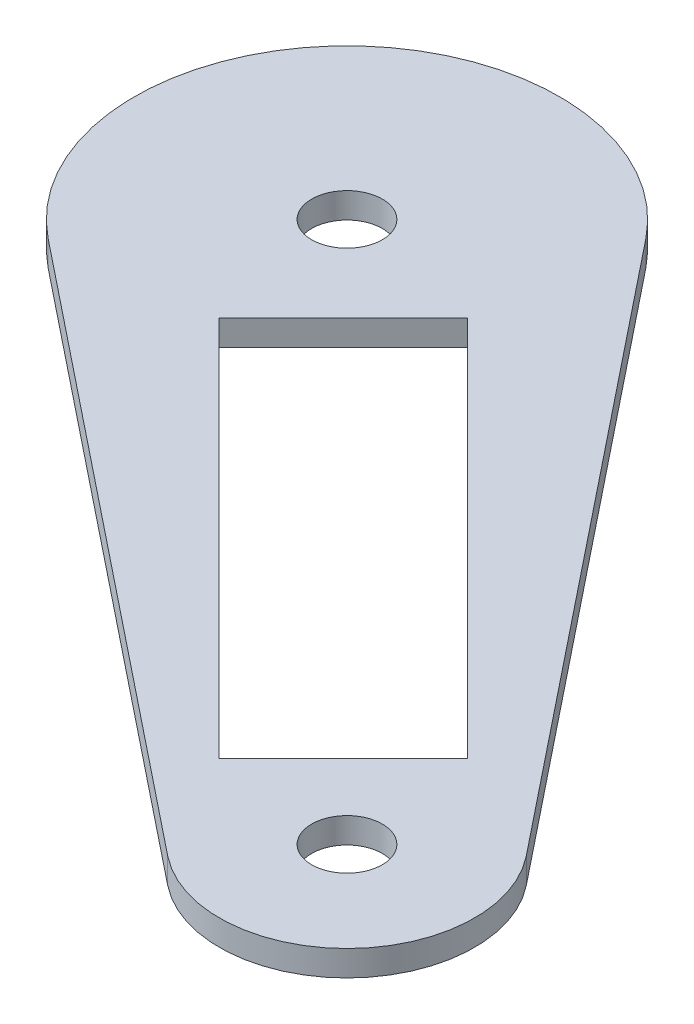
from build123d import *

# Parameters (mm, degrees)
SKETCH_1_R          = 4.15
EXTRUDE_1_DEPTH     = 3
EXTRUDE_2_DEPTH     = 12
CUT_EXTRUDE_1_DEPTH = 112.858735101
CUT_EXTRUDE_2_DEPTH = 112.858735101


with BuildPart() as part:
    # 草图1 → 凸台-拉伸1 (new body)
    with BuildSketch(Plane(origin=(0, 0, 0), x_dir=(1, 0, 0), z_dir=(0, 1, 0))):
        with BuildLine():
            ThreePointArc((19.532394726, 15.60402372), (-17.67766953, 17.67766953), (-15.60402372, -19.532394726))
            Line((-15.60402372, -19.532394726), (54.277196075, -75.359047143))
            ThreePointArc((54.277196075, -75.359047143), (74.246212025, -74.246212025), (75.359047143, -54.277196075))
            Line((75.359047143, -54.277196075), (19.532394726, 15.60402372))
        make_face()
        with Locations(Location((0, 0, 0), (0, 0, 270))):
            Circle(SKETCH_1_R, mode=Mode.SUBTRACT)
        with Locations(Location((63.639610307, -63.639610307, 0), (0, 0, 270))):
            Circle(SKETCH_1_R, mode=Mode.SUBTRACT)
    extrude(amount=EXTRUDE_1_DEPTH)

    # 草图3 → 凸台-拉伸2 (add)
    with BuildSketch(Plane(origin=(0, 3, 0), x_dir=(1, 0, 0), z_dir=(0, 1, 0))):
        with BuildLine():
            ThreePointArc((54.277196075, -75.359047143), (74.246212025, -74.246212025), (75.359047143, -54.277196075))
            Line((75.359047143, -54.277196075), (19.532394726, 15.60402372))
            ThreePointArc((19.532394726, 15.60402372), (-17.67766953, 17.67766953), (-15.60402372, -19.532394726))
            Line((-15.60402372, -19.532394726), (54.277196075, -75.359047143))
        make_face()
        with BuildLine():
            Line((17.969803148, 14.355701822), (73.796455565, -55.525517972))
            ThreePointArc((73.796455565, -55.525517972), (72.831998462, -72.831998462), (55.525517972, -73.796455565))
            Line((55.525517972, -73.796455565), (-14.355701822, -17.969803148))
            ThreePointArc((-14.355701822, -17.969803148), (-16.263455967, 16.263455967), (17.969803148, 14.355701822))
        make_face(mode=Mode.SUBTRACT)
    extrude(amount=EXTRUDE_2_DEPTH)

    # 草图4 → 切除-拉伸1 (cut, through all)
    with BuildSketch(Plane(origin=(0, 3, 0), x_dir=(1, 0, 0), z_dir=(0, 1, 0))):
        Polygon((17.133662373, -2.976992155), (10.055327264, -10.055327264), (54.909619217, -54.909619217), (61.987954325, -47.831284108), align=None)
        Polygon((54.909619217, -54.909619217), (10.055327264, -10.055327264), (2.529939412, -17.580715117), (47.384231364, -62.435007069), align=None)
    extrude(amount=-CUT_EXTRUDE_1_DEPTH, mode=Mode.SUBTRACT)

    # 草图5 → 切除-拉伸2 (cut, through all)
    with BuildSketch(Plane(origin=(0, 3, 0), x_dir=(1, 0, 0), z_dir=(0, 1, 0))):
        with BuildLine():
            Line((-6.700597737, -24.085306516), (-14.355701822, -17.969803148))
            ThreePointArc((-14.355701822, -17.969803148), (-16.263455967, 16.263455967), (17.969803148, 14.355701822))
            Line((17.969803148, 14.355701822), (24.085306516, 6.700597737))
            ThreePointArc((24.085306516, 6.700597737), (22.258564958, 11.382279474), (19.532394726, 15.60402372))
            ThreePointArc((19.532394726, 15.60402372), (-17.67766953, 17.67766953), (-15.60402372, -19.532394726))
            ThreePointArc((-15.60402372, -19.532394726), (-11.382279474, -22.258564958), (-6.700597737, -24.085306516))
        make_face()
        with BuildLine():
            Line((24.085306516, 6.700597737), (69.125662715, -49.678835652))
            ThreePointArc((69.125662715, -49.678835652), (72.544296976, -51.568713268), (75.359047143, -54.277196075))
            Line((75.359047143, -54.277196075), (19.532394726, 15.60402372))
            ThreePointArc((19.532394726, 15.60402372), (22.258564958, 11.382279474), (24.085306516, 6.700597737))
        make_face()
        with BuildLine():
            Line((49.678835652, -69.125662715), (-6.700597737, -24.085306516))
            ThreePointArc((-6.700597737, -24.085306516), (-11.382279474, -22.258564958), (-15.60402372, -19.532394726))
            Line((-15.60402372, -19.532394726), (54.277196075, -75.359047143))
            ThreePointArc((54.277196075, -75.359047143), (51.568713268, -72.544296976), (49.678835652, -69.125662715))
        make_face()
        with BuildLine():
            ThreePointArc((75.359047143, -54.277196075), (72.544296976, -51.568713268), (69.125662715, -49.678835652))
            Line((69.125662715, -49.678835652), (73.796455565, -55.525517972))
            ThreePointArc((73.796455565, -55.525517972), (75.908248951, -59.340714422), (76.639610307, -63.639610307))
            ThreePointArc((76.639610307, -63.639610307), (69.275069456, -75.354626319), (55.525517972, -73.796455565))
            Line((55.525517972, -73.796455565), (49.678835652, -69.125662715))
            ThreePointArc((49.678835652, -69.125662715), (51.568713268, -72.544296976), (54.277196075, -75.359047143))
            ThreePointArc((54.277196075, -75.359047143), (70.142063172, -77.156936475), (78.639610307, -63.639610307))
            ThreePointArc((78.639610307, -63.639610307), (77.795731819, -58.679345825), (75.359047143, -54.277196075))
        make_face()
    extrude(amount=CUT_EXTRUDE_2_DEPTH, mode=Mode.SUBTRACT)


solid = part.part
